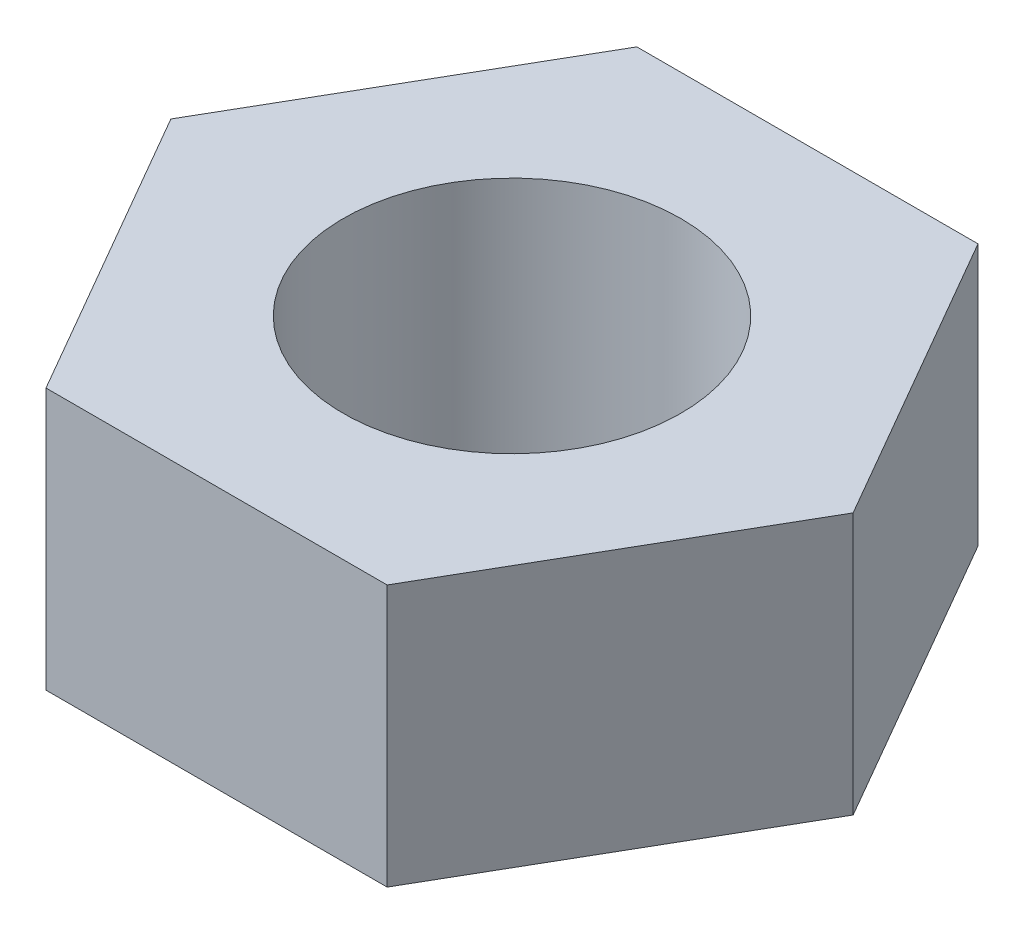
from build123d import *

# Parameters (mm, degrees)
EXTRUDE_1_DEPTH     = 3.1
SKETCH_3_R          = 2
CUT_EXTRUDE_1_DEPTH = 7.180075512


with BuildPart() as part:
    # 草图1 → 凸台-拉伸1 (new body)
    with BuildSketch(Plane(origin=(0, 0, 0), x_dir=(1, 0, 0), z_dir=(0, 1, 0))):
        Polygon((4.041451884, 0), (2.020725942, 3.5), (-2.020725942, 3.5), (-4.041451884, 0), (-2.020725942, -3.5), (2.020725942, -3.5), align=None)
    extrude(amount=EXTRUDE_1_DEPTH)

    # 草图3 → 切除-拉伸1 (cut, through all)
    with BuildSketch(Plane.XZ):
        Circle(SKETCH_3_R)
    extrude(amount=-CUT_EXTRUDE_1_DEPTH, mode=Mode.SUBTRACT)


solid = part.part
